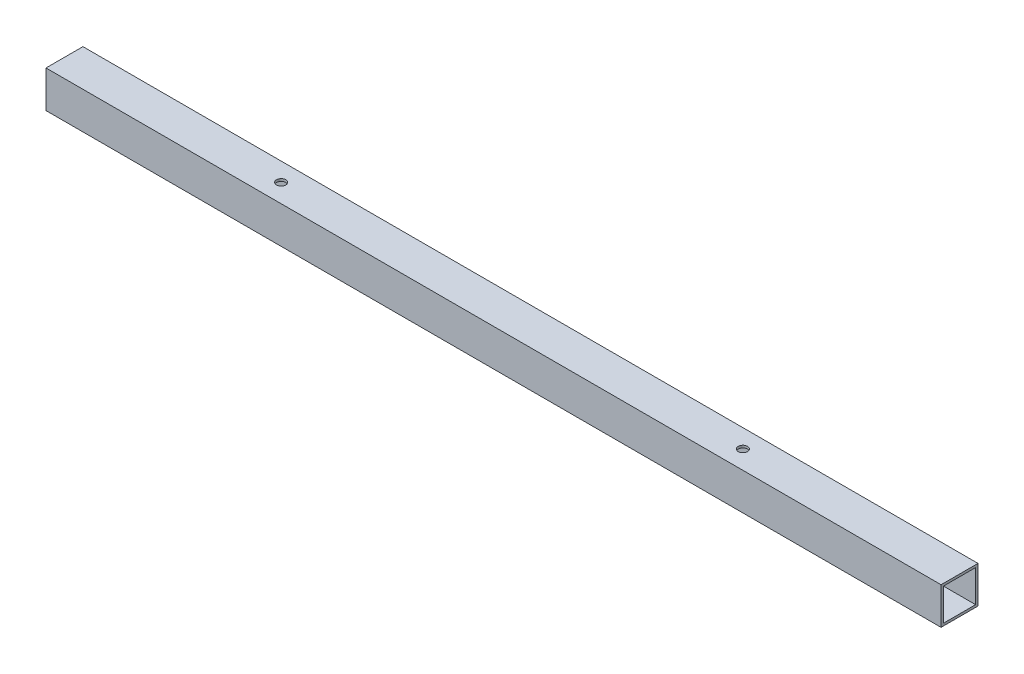
from build123d import *

# Parameters (mm, degrees)
SKETCH16_W                                     = 25.4
SKETCH16_H                                     = 25.4
SKETCH16_W_2                                   = 22.098
SKETCH16_H_2                                   = 22.098
AL_TUBE_SQUARE_AL_TUBE_1_SQR_X_0_065_WAL_DEPTH = 615.4
F_1_4_0_25_DIAMETER_HOLE1_D                    = 6.35


with BuildPart() as part:
    # Sketch16 → Al tube square AL TUBE 1 SQR X 0.065 WALL(1) (new body)
    with BuildSketch(Plane(origin=(0, 0, 0), x_dir=(0, 0, -1), z_dir=(1, 0, 0))):
        Rectangle(SKETCH16_W, SKETCH16_H)
        Rectangle(SKETCH16_W_2, SKETCH16_H_2, mode=Mode.SUBTRACT)
    extrude(amount=AL_TUBE_SQUARE_AL_TUBE_1_SQR_X_0_065_WAL_DEPTH)

    # 1/4 (0.25) Diameter Hole1 (through all)
    with Locations(Plane(origin=(0, 12.7, 0), x_dir=(1, 0, 0), z_dir=(0, 1, 0))):
        with Locations((466.45, 0), (148.95, 0)):
            Hole(F_1_4_0_25_DIAMETER_HOLE1_D / 2)


solid = part.part
